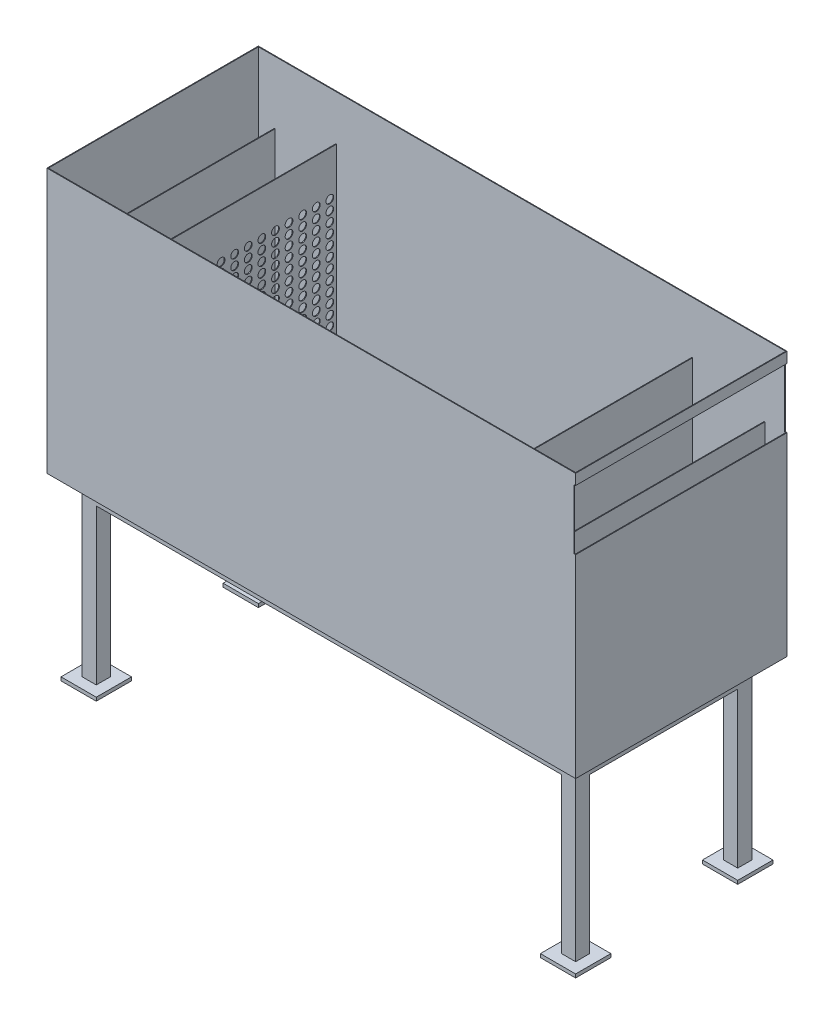
from build123d import *

# Parameters (mm, degrees)
MASTER_FOOTPRINT_W             = 1500
MASTER_FOOTPRINT_H             = 600
BATH_BASE_PLATE_DEPTH          = 750
BATH_SHELL_2MM_T               = -2
SKETCH_1_R                     = 50
INLET_D100_OPENING_DEPTH       = 10
INLET_IMPACT_BAFFLE_START      = 125
SKETCH_2_W                     = 440
SKETCH_2_H                     = 430
INLET_IMPACT_BAFFLE_DEPTH      = 2
DISTRIBUTOR_D22_START          = 250
SKETCH_3_W                     = 540
SKETCH_3_H                     = 648
SKETCH_3_R                     = 11
DISTRIBUTOR_D22_DEPTH          = 2
OUTLET_SUBMERGED_BAFFLE_START  = 1280
SKETCH_4_W                     = 500
SKETCH_4_H                     = 330
OUTLET_SUBMERGED_BAFFLE_DEPTH  = 2
OVERFLOW_WEIR_Z550_START       = 1440
SKETCH_5_W                     = 590
SKETCH_5_H                     = 548
OVERFLOW_WEIR_Z550_DEPTH       = 2
OUTLET_WEIR_SLOT_W600_START    = 1495
SKETCH_6_W                     = 600
SKETCH_6_H                     = 170
OUTLET_WEIR_SLOT_W600_DEPTH    = 10
SLOPED_SEDIMENT_FLOOR_START    = 275
SLOPED_SEDIMENT_FLOOR_DEPTH    = 975
SKETCH_8_W                     = 40
SKETCH_8_H                     = 40
FRAME_LEGS_40X40_H500_DEPTH    = 500
FRAME_LONGITUDINAL_RAILS_START = -20
SKETCH_9_W                     = 1400
SKETCH_9_H                     = 40
FRAME_LONGITUDINAL_RAILS_DEPTH = 40
FRAME_TRANSVERSE_RAILS_START   = -20
SKETCH_10_W                    = 40
SKETCH_10_H                    = 420
FRAME_TRANSVERSE_RAILS_DEPTH   = 40
FRAME_FOOT_PADS_100X100_START  = -500
SKETCH_11_W                    = 100
SKETCH_11_H                    = 100
FRAME_FOOT_PADS_100X100_DEPTH  = 10


with BuildPart() as part:
    # MASTER_FOOTPRINT → BATH_BASE_PLATE (new body)
    with BuildSketch(Plane(origin=(0, 0, 0), x_dir=(1, 0, 0), z_dir=(0, 1, 0))):
        with Locations((750, 300)):
            Rectangle(MASTER_FOOTPRINT_W, MASTER_FOOTPRINT_H)
    extrude(amount=BATH_BASE_PLATE_DEPTH)

    # BATH_SHELL_2MM
    bath_shell_2mm_openings = [part.faces().sort_by_distance(p)[0] for p in [
        (750, 750, -300),
    ]]
    offset(amount=BATH_SHELL_2MM_T, openings=bath_shell_2mm_openings, kind=Kind.INTERSECTION)

    # Эскиз1 → INLET_D100_OPENING (cut)
    with BuildSketch(Plane(origin=(0, 0, 0), x_dir=(0, 0, -1), z_dir=(1, 0, 0))):
        with Locations((300, 420)):
            Circle(SKETCH_1_R)
    extrude(amount=INLET_D100_OPENING_DEPTH, mode=Mode.SUBTRACT)

    # Эскиз6 → OUTLET_WEIR_SLOT_W600 (cut)
    with BuildSketch(Plane(origin=(0, 0, 0), x_dir=(0, 0, -1), z_dir=(1, 0, 0)).offset(OUTLET_WEIR_SLOT_W600_START)):
        with Locations((300, 635)):
            Rectangle(SKETCH_6_W, SKETCH_6_H)
    extrude(amount=OUTLET_WEIR_SLOT_W600_DEPTH, mode=Mode.SUBTRACT)

    # Эскиз7 → SLOPED_SEDIMENT_FLOOR (add)
    with BuildSketch(Plane(origin=(0, 0, 0), x_dir=(0, 0, -1), z_dir=(1, 0, 0)).offset(SLOPED_SEDIMENT_FLOOR_START)):
        Polygon((2, -1), (2, 120), (230, -1), align=None)
        Polygon((598, -1), (598, 120), (370, -1), align=None)
    extrude(amount=SLOPED_SEDIMENT_FLOOR_DEPTH)

    # Эскиз8 → FRAME_LEGS_40X40_H500 (add)
    with BuildSketch(Plane(origin=(0, 0, 0), x_dir=(1, 0, 0), z_dir=(0, 1, 0))):
        with Locations((70, 70)):
            Rectangle(SKETCH_8_W, SKETCH_8_H)
        with Locations((70, 530)):
            Rectangle(SKETCH_8_W, SKETCH_8_H)
        with Locations((1430, 70)):
            Rectangle(SKETCH_8_W, SKETCH_8_H)
        with Locations((1430, 530)):
            Rectangle(SKETCH_8_W, SKETCH_8_H)
    extrude(amount=-FRAME_LEGS_40X40_H500_DEPTH)

    # Эскиз9 → FRAME_LONGITUDINAL_RAILS (add)
    with BuildSketch(Plane(origin=(0, 0, 0), x_dir=(1, 0, 0), z_dir=(0, 1, 0)).offset(FRAME_LONGITUDINAL_RAILS_START)):
        with Locations((750, 70)):
            Rectangle(SKETCH_9_W, SKETCH_9_H)
        with Locations((750, 530)):
            Rectangle(SKETCH_9_W, SKETCH_9_H)
    extrude(amount=-FRAME_LONGITUDINAL_RAILS_DEPTH)

    # Эскиз10 → FRAME_TRANSVERSE_RAILS (add)
    with BuildSketch(Plane(origin=(0, 0, 0), x_dir=(1, 0, 0), z_dir=(0, 1, 0)).offset(FRAME_TRANSVERSE_RAILS_START)):
        with Locations((70, 300)):
            Rectangle(SKETCH_10_W, SKETCH_10_H)
        with Locations((1430, 300)):
            Rectangle(SKETCH_10_W, SKETCH_10_H)
    extrude(amount=-FRAME_TRANSVERSE_RAILS_DEPTH)

    # Эскиз11 → FRAME_FOOT_PADS_100X100 (add)
    with BuildSketch(Plane(origin=(0, 0, 0), x_dir=(1, 0, 0), z_dir=(0, 1, 0)).offset(FRAME_FOOT_PADS_100X100_START)):
        with Locations((70, 70)):
            Rectangle(SKETCH_11_W, SKETCH_11_H)
        with Locations((70, 530)):
            Rectangle(SKETCH_11_W, SKETCH_11_H)
        with Locations((1430, 70)):
            Rectangle(SKETCH_11_W, SKETCH_11_H)
        with Locations((1430, 530)):
            Rectangle(SKETCH_11_W, SKETCH_11_H)
    extrude(amount=-FRAME_FOOT_PADS_100X100_DEPTH)


with BuildPart() as body_2:
    # Эскиз2 → INLET_IMPACT_BAFFLE (new body)
    with BuildSketch(Plane(origin=(0, 0, 0), x_dir=(0, 0, -1), z_dir=(1, 0, 0)).offset(INLET_IMPACT_BAFFLE_START)):
        with Locations((300, 435)):
            Rectangle(SKETCH_2_W, SKETCH_2_H)
    extrude(amount=INLET_IMPACT_BAFFLE_DEPTH)


with BuildPart() as body_3:
    # Эскиз3 → DISTRIBUTOR_D22 (new body)
    with BuildSketch(Plane(origin=(0, 0, 0), x_dir=(0, 0, -1), z_dir=(1, 0, 0)).offset(DISTRIBUTOR_D22_START)):
        with Locations((300, 326)):
            Rectangle(SKETCH_3_W, SKETCH_3_H)
        with Locations((49.285714286, 125)):
            Circle(SKETCH_3_R, mode=Mode.SUBTRACT)
        with Locations((49.285714286, 153.5)):
            Circle(SKETCH_3_R, mode=Mode.SUBTRACT)
        with Locations((49.285714286, 182)):
            Circle(SKETCH_3_R, mode=Mode.SUBTRACT)
        with Locations((49.285714286, 210.5)):
            Circle(SKETCH_3_R, mode=Mode.SUBTRACT)
        with Locations((49.285714286, 239)):
            Circle(SKETCH_3_R, mode=Mode.SUBTRACT)
        with Locations((49.285714286, 267.5)):
            Circle(SKETCH_3_R, mode=Mode.SUBTRACT)
        with Locations((49.285714286, 296)):
            Circle(SKETCH_3_R, mode=Mode.SUBTRACT)
        with Locations((49.285714286, 324.5)):
            Circle(SKETCH_3_R, mode=Mode.SUBTRACT)
        with Locations((49.285714286, 353)):
            Circle(SKETCH_3_R, mode=Mode.SUBTRACT)
        with Locations((49.285714286, 381.5)):
            Circle(SKETCH_3_R, mode=Mode.SUBTRACT)
        with Locations((49.285714286, 410)):
            Circle(SKETCH_3_R, mode=Mode.SUBTRACT)
        with Locations((49.285714286, 438.5)):
            Circle(SKETCH_3_R, mode=Mode.SUBTRACT)
        with Locations((49.285714286, 467)):
            Circle(SKETCH_3_R, mode=Mode.SUBTRACT)
        with Locations((49.285714286, 495.5)):
            Circle(SKETCH_3_R, mode=Mode.SUBTRACT)
        with Locations((49.285714286, 524)):
            Circle(SKETCH_3_R, mode=Mode.SUBTRACT)
        with Locations((87.857142857, 125)):
            Circle(SKETCH_3_R, mode=Mode.SUBTRACT)
        with Locations((87.857142857, 153.5)):
            Circle(SKETCH_3_R, mode=Mode.SUBTRACT)
        with Locations((87.857142857, 182)):
            Circle(SKETCH_3_R, mode=Mode.SUBTRACT)
        with Locations((87.857142857, 210.5)):
            Circle(SKETCH_3_R, mode=Mode.SUBTRACT)
        with Locations((87.857142857, 239)):
            Circle(SKETCH_3_R, mode=Mode.SUBTRACT)
        with Locations((87.857142857, 267.5)):
            Circle(SKETCH_3_R, mode=Mode.SUBTRACT)
        with Locations((87.857142857, 296)):
            Circle(SKETCH_3_R, mode=Mode.SUBTRACT)
        with Locations((87.857142857, 324.5)):
            Circle(SKETCH_3_R, mode=Mode.SUBTRACT)
        with Locations((87.857142857, 353)):
            Circle(SKETCH_3_R, mode=Mode.SUBTRACT)
        with Locations((87.857142857, 381.5)):
            Circle(SKETCH_3_R, mode=Mode.SUBTRACT)
        with Locations((87.857142857, 410)):
            Circle(SKETCH_3_R, mode=Mode.SUBTRACT)
        with Locations((87.857142857, 438.5)):
            Circle(SKETCH_3_R, mode=Mode.SUBTRACT)
        with Locations((87.857142857, 467)):
            Circle(SKETCH_3_R, mode=Mode.SUBTRACT)
        with Locations((87.857142857, 495.5)):
            Circle(SKETCH_3_R, mode=Mode.SUBTRACT)
        with Locations((87.857142857, 524)):
            Circle(SKETCH_3_R, mode=Mode.SUBTRACT)
        with Locations((126.428571429, 125)):
            Circle(SKETCH_3_R, mode=Mode.SUBTRACT)
        with Locations((126.428571429, 153.5)):
            Circle(SKETCH_3_R, mode=Mode.SUBTRACT)
        with Locations((126.428571429, 182)):
            Circle(SKETCH_3_R, mode=Mode.SUBTRACT)
        with Locations((126.428571429, 210.5)):
            Circle(SKETCH_3_R, mode=Mode.SUBTRACT)
        with Locations((126.428571429, 239)):
            Circle(SKETCH_3_R, mode=Mode.SUBTRACT)
        with Locations((126.428571429, 267.5)):
            Circle(SKETCH_3_R, mode=Mode.SUBTRACT)
        with Locations((126.428571429, 296)):
            Circle(SKETCH_3_R, mode=Mode.SUBTRACT)
        with Locations((126.428571429, 324.5)):
            Circle(SKETCH_3_R, mode=Mode.SUBTRACT)
        with Locations((126.428571429, 353)):
            Circle(SKETCH_3_R, mode=Mode.SUBTRACT)
        with Locations((126.428571429, 381.5)):
            Circle(SKETCH_3_R, mode=Mode.SUBTRACT)
        with Locations((126.428571429, 410)):
            Circle(SKETCH_3_R, mode=Mode.SUBTRACT)
        with Locations((126.428571429, 438.5)):
            Circle(SKETCH_3_R, mode=Mode.SUBTRACT)
        with Locations((126.428571429, 467)):
            Circle(SKETCH_3_R, mode=Mode.SUBTRACT)
        with Locations((126.428571429, 495.5)):
            Circle(SKETCH_3_R, mode=Mode.SUBTRACT)
        with Locations((126.428571429, 524)):
            Circle(SKETCH_3_R, mode=Mode.SUBTRACT)
        with Locations((165, 125)):
            Circle(SKETCH_3_R, mode=Mode.SUBTRACT)
        with Locations((165, 153.5)):
            Circle(SKETCH_3_R, mode=Mode.SUBTRACT)
        with Locations((165, 182)):
            Circle(SKETCH_3_R, mode=Mode.SUBTRACT)
        with Locations((165, 210.5)):
            Circle(SKETCH_3_R, mode=Mode.SUBTRACT)
        with Locations((165, 239)):
            Circle(SKETCH_3_R, mode=Mode.SUBTRACT)
        with Locations((165, 267.5)):
            Circle(SKETCH_3_R, mode=Mode.SUBTRACT)
        with Locations((165, 296)):
            Circle(SKETCH_3_R, mode=Mode.SUBTRACT)
        with Locations((165, 324.5)):
            Circle(SKETCH_3_R, mode=Mode.SUBTRACT)
        with Locations((165, 353)):
            Circle(SKETCH_3_R, mode=Mode.SUBTRACT)
        with Locations((165, 381.5)):
            Circle(SKETCH_3_R, mode=Mode.SUBTRACT)
        with Locations((165, 410)):
            Circle(SKETCH_3_R, mode=Mode.SUBTRACT)
        with Locations((165, 438.5)):
            Circle(SKETCH_3_R, mode=Mode.SUBTRACT)
        with Locations((165, 467)):
            Circle(SKETCH_3_R, mode=Mode.SUBTRACT)
        with Locations((165, 495.5)):
            Circle(SKETCH_3_R, mode=Mode.SUBTRACT)
        with Locations((165, 524)):
            Circle(SKETCH_3_R, mode=Mode.SUBTRACT)
        with Locations((203.571428571, 125)):
            Circle(SKETCH_3_R, mode=Mode.SUBTRACT)
        with Locations((203.571428571, 153.5)):
            Circle(SKETCH_3_R, mode=Mode.SUBTRACT)
        with Locations((203.571428571, 182)):
            Circle(SKETCH_3_R, mode=Mode.SUBTRACT)
        with Locations((203.571428571, 210.5)):
            Circle(SKETCH_3_R, mode=Mode.SUBTRACT)
        with Locations((203.571428571, 239)):
            Circle(SKETCH_3_R, mode=Mode.SUBTRACT)
        with Locations((203.571428571, 267.5)):
            Circle(SKETCH_3_R, mode=Mode.SUBTRACT)
        with Locations((203.571428571, 296)):
            Circle(SKETCH_3_R, mode=Mode.SUBTRACT)
        with Locations((203.571428571, 324.5)):
            Circle(SKETCH_3_R, mode=Mode.SUBTRACT)
        with Locations((203.571428571, 353)):
            Circle(SKETCH_3_R, mode=Mode.SUBTRACT)
        with Locations((203.571428571, 381.5)):
            Circle(SKETCH_3_R, mode=Mode.SUBTRACT)
        with Locations((203.571428571, 410)):
            Circle(SKETCH_3_R, mode=Mode.SUBTRACT)
        with Locations((203.571428571, 438.5)):
            Circle(SKETCH_3_R, mode=Mode.SUBTRACT)
        with Locations((203.571428571, 467)):
            Circle(SKETCH_3_R, mode=Mode.SUBTRACT)
        with Locations((203.571428571, 495.5)):
            Circle(SKETCH_3_R, mode=Mode.SUBTRACT)
        with Locations((203.571428571, 524)):
            Circle(SKETCH_3_R, mode=Mode.SUBTRACT)
        with Locations((242.142857143, 125)):
            Circle(SKETCH_3_R, mode=Mode.SUBTRACT)
        with Locations((242.142857143, 153.5)):
            Circle(SKETCH_3_R, mode=Mode.SUBTRACT)
        with Locations((242.142857143, 182)):
            Circle(SKETCH_3_R, mode=Mode.SUBTRACT)
        with Locations((242.142857143, 210.5)):
            Circle(SKETCH_3_R, mode=Mode.SUBTRACT)
        with Locations((242.142857143, 239)):
            Circle(SKETCH_3_R, mode=Mode.SUBTRACT)
        with Locations((242.142857143, 267.5)):
            Circle(SKETCH_3_R, mode=Mode.SUBTRACT)
        with Locations((242.142857143, 296)):
            Circle(SKETCH_3_R, mode=Mode.SUBTRACT)
        with Locations((242.142857143, 324.5)):
            Circle(SKETCH_3_R, mode=Mode.SUBTRACT)
        with Locations((242.142857143, 353)):
            Circle(SKETCH_3_R, mode=Mode.SUBTRACT)
        with Locations((242.142857143, 381.5)):
            Circle(SKETCH_3_R, mode=Mode.SUBTRACT)
        with Locations((242.142857143, 410)):
            Circle(SKETCH_3_R, mode=Mode.SUBTRACT)
        with Locations((242.142857143, 438.5)):
            Circle(SKETCH_3_R, mode=Mode.SUBTRACT)
        with Locations((242.142857143, 467)):
            Circle(SKETCH_3_R, mode=Mode.SUBTRACT)
        with Locations((242.142857143, 495.5)):
            Circle(SKETCH_3_R, mode=Mode.SUBTRACT)
        with Locations((242.142857143, 524)):
            Circle(SKETCH_3_R, mode=Mode.SUBTRACT)
        with Locations((280.714285714, 125)):
            Circle(SKETCH_3_R, mode=Mode.SUBTRACT)
        with Locations((280.714285714, 153.5)):
            Circle(SKETCH_3_R, mode=Mode.SUBTRACT)
        with Locations((280.714285714, 182)):
            Circle(SKETCH_3_R, mode=Mode.SUBTRACT)
        with Locations((280.714285714, 210.5)):
            Circle(SKETCH_3_R, mode=Mode.SUBTRACT)
        with Locations((280.714285714, 239)):
            Circle(SKETCH_3_R, mode=Mode.SUBTRACT)
        with Locations((280.714285714, 267.5)):
            Circle(SKETCH_3_R, mode=Mode.SUBTRACT)
        with Locations((280.714285714, 296)):
            Circle(SKETCH_3_R, mode=Mode.SUBTRACT)
        with Locations((280.714285714, 324.5)):
            Circle(SKETCH_3_R, mode=Mode.SUBTRACT)
        with Locations((280.714285714, 353)):
            Circle(SKETCH_3_R, mode=Mode.SUBTRACT)
        with Locations((280.714285714, 381.5)):
            Circle(SKETCH_3_R, mode=Mode.SUBTRACT)
        with Locations((280.714285714, 410)):
            Circle(SKETCH_3_R, mode=Mode.SUBTRACT)
        with Locations((280.714285714, 438.5)):
            Circle(SKETCH_3_R, mode=Mode.SUBTRACT)
        with Locations((280.714285714, 467)):
            Circle(SKETCH_3_R, mode=Mode.SUBTRACT)
        with Locations((280.714285714, 495.5)):
            Circle(SKETCH_3_R, mode=Mode.SUBTRACT)
        with Locations((280.714285714, 524)):
            Circle(SKETCH_3_R, mode=Mode.SUBTRACT)
        with Locations((319.285714286, 125)):
            Circle(SKETCH_3_R, mode=Mode.SUBTRACT)
        with Locations((319.285714286, 153.5)):
            Circle(SKETCH_3_R, mode=Mode.SUBTRACT)
        with Locations((319.285714286, 182)):
            Circle(SKETCH_3_R, mode=Mode.SUBTRACT)
        with Locations((319.285714286, 210.5)):
            Circle(SKETCH_3_R, mode=Mode.SUBTRACT)
        with Locations((319.285714286, 239)):
            Circle(SKETCH_3_R, mode=Mode.SUBTRACT)
        with Locations((319.285714286, 267.5)):
            Circle(SKETCH_3_R, mode=Mode.SUBTRACT)
        with Locations((319.285714286, 296)):
            Circle(SKETCH_3_R, mode=Mode.SUBTRACT)
        with Locations((319.285714286, 324.5)):
            Circle(SKETCH_3_R, mode=Mode.SUBTRACT)
        with Locations((319.285714286, 353)):
            Circle(SKETCH_3_R, mode=Mode.SUBTRACT)
        with Locations((319.285714286, 381.5)):
            Circle(SKETCH_3_R, mode=Mode.SUBTRACT)
        with Locations((319.285714286, 410)):
            Circle(SKETCH_3_R, mode=Mode.SUBTRACT)
        with Locations((319.285714286, 438.5)):
            Circle(SKETCH_3_R, mode=Mode.SUBTRACT)
        with Locations((319.285714286, 467)):
            Circle(SKETCH_3_R, mode=Mode.SUBTRACT)
        with Locations((319.285714286, 495.5)):
            Circle(SKETCH_3_R, mode=Mode.SUBTRACT)
        with Locations((319.285714286, 524)):
            Circle(SKETCH_3_R, mode=Mode.SUBTRACT)
        with Locations((357.857142857, 125)):
            Circle(SKETCH_3_R, mode=Mode.SUBTRACT)
        with Locations((357.857142857, 153.5)):
            Circle(SKETCH_3_R, mode=Mode.SUBTRACT)
        with Locations((357.857142857, 182)):
            Circle(SKETCH_3_R, mode=Mode.SUBTRACT)
        with Locations((357.857142857, 210.5)):
            Circle(SKETCH_3_R, mode=Mode.SUBTRACT)
        with Locations((357.857142857, 239)):
            Circle(SKETCH_3_R, mode=Mode.SUBTRACT)
        with Locations((357.857142857, 267.5)):
            Circle(SKETCH_3_R, mode=Mode.SUBTRACT)
        with Locations((357.857142857, 296)):
            Circle(SKETCH_3_R, mode=Mode.SUBTRACT)
        with Locations((357.857142857, 324.5)):
            Circle(SKETCH_3_R, mode=Mode.SUBTRACT)
        with Locations((357.857142857, 353)):
            Circle(SKETCH_3_R, mode=Mode.SUBTRACT)
        with Locations((357.857142857, 381.5)):
            Circle(SKETCH_3_R, mode=Mode.SUBTRACT)
        with Locations((357.857142857, 410)):
            Circle(SKETCH_3_R, mode=Mode.SUBTRACT)
        with Locations((357.857142857, 438.5)):
            Circle(SKETCH_3_R, mode=Mode.SUBTRACT)
        with Locations((357.857142857, 467)):
            Circle(SKETCH_3_R, mode=Mode.SUBTRACT)
        with Locations((357.857142857, 495.5)):
            Circle(SKETCH_3_R, mode=Mode.SUBTRACT)
        with Locations((357.857142857, 524)):
            Circle(SKETCH_3_R, mode=Mode.SUBTRACT)
        with Locations((396.428571429, 125)):
            Circle(SKETCH_3_R, mode=Mode.SUBTRACT)
        with Locations((396.428571429, 153.5)):
            Circle(SKETCH_3_R, mode=Mode.SUBTRACT)
        with Locations((396.428571429, 182)):
            Circle(SKETCH_3_R, mode=Mode.SUBTRACT)
        with Locations((396.428571429, 210.5)):
            Circle(SKETCH_3_R, mode=Mode.SUBTRACT)
        with Locations((396.428571429, 239)):
            Circle(SKETCH_3_R, mode=Mode.SUBTRACT)
        with Locations((396.428571429, 267.5)):
            Circle(SKETCH_3_R, mode=Mode.SUBTRACT)
        with Locations((396.428571429, 296)):
            Circle(SKETCH_3_R, mode=Mode.SUBTRACT)
        with Locations((396.428571429, 324.5)):
            Circle(SKETCH_3_R, mode=Mode.SUBTRACT)
        with Locations((396.428571429, 353)):
            Circle(SKETCH_3_R, mode=Mode.SUBTRACT)
        with Locations((396.428571429, 381.5)):
            Circle(SKETCH_3_R, mode=Mode.SUBTRACT)
        with Locations((396.428571429, 410)):
            Circle(SKETCH_3_R, mode=Mode.SUBTRACT)
        with Locations((396.428571429, 438.5)):
            Circle(SKETCH_3_R, mode=Mode.SUBTRACT)
        with Locations((396.428571429, 467)):
            Circle(SKETCH_3_R, mode=Mode.SUBTRACT)
        with Locations((396.428571429, 495.5)):
            Circle(SKETCH_3_R, mode=Mode.SUBTRACT)
        with Locations((396.428571429, 524)):
            Circle(SKETCH_3_R, mode=Mode.SUBTRACT)
        with Locations((435, 125)):
            Circle(SKETCH_3_R, mode=Mode.SUBTRACT)
        with Locations((435, 153.5)):
            Circle(SKETCH_3_R, mode=Mode.SUBTRACT)
        with Locations((435, 182)):
            Circle(SKETCH_3_R, mode=Mode.SUBTRACT)
        with Locations((435, 210.5)):
            Circle(SKETCH_3_R, mode=Mode.SUBTRACT)
        with Locations((435, 239)):
            Circle(SKETCH_3_R, mode=Mode.SUBTRACT)
        with Locations((435, 267.5)):
            Circle(SKETCH_3_R, mode=Mode.SUBTRACT)
        with Locations((435, 296)):
            Circle(SKETCH_3_R, mode=Mode.SUBTRACT)
        with Locations((435, 324.5)):
            Circle(SKETCH_3_R, mode=Mode.SUBTRACT)
        with Locations((435, 353)):
            Circle(SKETCH_3_R, mode=Mode.SUBTRACT)
        with Locations((435, 381.5)):
            Circle(SKETCH_3_R, mode=Mode.SUBTRACT)
        with Locations((435, 410)):
            Circle(SKETCH_3_R, mode=Mode.SUBTRACT)
        with Locations((435, 438.5)):
            Circle(SKETCH_3_R, mode=Mode.SUBTRACT)
        with Locations((435, 467)):
            Circle(SKETCH_3_R, mode=Mode.SUBTRACT)
        with Locations((435, 495.5)):
            Circle(SKETCH_3_R, mode=Mode.SUBTRACT)
        with Locations((435, 524)):
            Circle(SKETCH_3_R, mode=Mode.SUBTRACT)
        with Locations((473.571428571, 125)):
            Circle(SKETCH_3_R, mode=Mode.SUBTRACT)
        with Locations((473.571428571, 153.5)):
            Circle(SKETCH_3_R, mode=Mode.SUBTRACT)
        with Locations((473.571428571, 182)):
            Circle(SKETCH_3_R, mode=Mode.SUBTRACT)
        with Locations((473.571428571, 210.5)):
            Circle(SKETCH_3_R, mode=Mode.SUBTRACT)
        with Locations((473.571428571, 239)):
            Circle(SKETCH_3_R, mode=Mode.SUBTRACT)
        with Locations((473.571428571, 267.5)):
            Circle(SKETCH_3_R, mode=Mode.SUBTRACT)
        with Locations((473.571428571, 296)):
            Circle(SKETCH_3_R, mode=Mode.SUBTRACT)
        with Locations((473.571428571, 324.5)):
            Circle(SKETCH_3_R, mode=Mode.SUBTRACT)
        with Locations((473.571428571, 353)):
            Circle(SKETCH_3_R, mode=Mode.SUBTRACT)
        with Locations((473.571428571, 381.5)):
            Circle(SKETCH_3_R, mode=Mode.SUBTRACT)
        with Locations((473.571428571, 410)):
            Circle(SKETCH_3_R, mode=Mode.SUBTRACT)
        with Locations((473.571428571, 438.5)):
            Circle(SKETCH_3_R, mode=Mode.SUBTRACT)
        with Locations((473.571428571, 467)):
            Circle(SKETCH_3_R, mode=Mode.SUBTRACT)
        with Locations((473.571428571, 495.5)):
            Circle(SKETCH_3_R, mode=Mode.SUBTRACT)
        with Locations((473.571428571, 524)):
            Circle(SKETCH_3_R, mode=Mode.SUBTRACT)
        with Locations((512.142857143, 125)):
            Circle(SKETCH_3_R, mode=Mode.SUBTRACT)
        with Locations((512.142857143, 153.5)):
            Circle(SKETCH_3_R, mode=Mode.SUBTRACT)
        with Locations((512.142857143, 182)):
            Circle(SKETCH_3_R, mode=Mode.SUBTRACT)
        with Locations((512.142857143, 210.5)):
            Circle(SKETCH_3_R, mode=Mode.SUBTRACT)
        with Locations((512.142857143, 239)):
            Circle(SKETCH_3_R, mode=Mode.SUBTRACT)
        with Locations((512.142857143, 267.5)):
            Circle(SKETCH_3_R, mode=Mode.SUBTRACT)
        with Locations((512.142857143, 296)):
            Circle(SKETCH_3_R, mode=Mode.SUBTRACT)
        with Locations((512.142857143, 324.5)):
            Circle(SKETCH_3_R, mode=Mode.SUBTRACT)
        with Locations((512.142857143, 353)):
            Circle(SKETCH_3_R, mode=Mode.SUBTRACT)
        with Locations((512.142857143, 381.5)):
            Circle(SKETCH_3_R, mode=Mode.SUBTRACT)
        with Locations((512.142857143, 410)):
            Circle(SKETCH_3_R, mode=Mode.SUBTRACT)
        with Locations((512.142857143, 438.5)):
            Circle(SKETCH_3_R, mode=Mode.SUBTRACT)
        with Locations((512.142857143, 467)):
            Circle(SKETCH_3_R, mode=Mode.SUBTRACT)
        with Locations((512.142857143, 495.5)):
            Circle(SKETCH_3_R, mode=Mode.SUBTRACT)
        with Locations((512.142857143, 524)):
            Circle(SKETCH_3_R, mode=Mode.SUBTRACT)
        with Locations((550.714285714, 125)):
            Circle(SKETCH_3_R, mode=Mode.SUBTRACT)
        with Locations((550.714285714, 153.5)):
            Circle(SKETCH_3_R, mode=Mode.SUBTRACT)
        with Locations((550.714285714, 182)):
            Circle(SKETCH_3_R, mode=Mode.SUBTRACT)
        with Locations((550.714285714, 210.5)):
            Circle(SKETCH_3_R, mode=Mode.SUBTRACT)
        with Locations((550.714285714, 239)):
            Circle(SKETCH_3_R, mode=Mode.SUBTRACT)
        with Locations((550.714285714, 267.5)):
            Circle(SKETCH_3_R, mode=Mode.SUBTRACT)
        with Locations((550.714285714, 296)):
            Circle(SKETCH_3_R, mode=Mode.SUBTRACT)
        with Locations((550.714285714, 324.5)):
            Circle(SKETCH_3_R, mode=Mode.SUBTRACT)
        with Locations((550.714285714, 353)):
            Circle(SKETCH_3_R, mode=Mode.SUBTRACT)
        with Locations((550.714285714, 381.5)):
            Circle(SKETCH_3_R, mode=Mode.SUBTRACT)
        with Locations((550.714285714, 410)):
            Circle(SKETCH_3_R, mode=Mode.SUBTRACT)
        with Locations((550.714285714, 438.5)):
            Circle(SKETCH_3_R, mode=Mode.SUBTRACT)
        with Locations((550.714285714, 467)):
            Circle(SKETCH_3_R, mode=Mode.SUBTRACT)
        with Locations((550.714285714, 495.5)):
            Circle(SKETCH_3_R, mode=Mode.SUBTRACT)
        with Locations((550.714285714, 524)):
            Circle(SKETCH_3_R, mode=Mode.SUBTRACT)
    extrude(amount=DISTRIBUTOR_D22_DEPTH)


with BuildPart() as body_4:
    # Эскиз4 → OUTLET_SUBMERGED_BAFFLE (new body)
    with BuildSketch(Plane(origin=(0, 0, 0), x_dir=(0, 0, -1), z_dir=(1, 0, 0)).offset(OUTLET_SUBMERGED_BAFFLE_START)):
        with Locations((300, 485)):
            Rectangle(SKETCH_4_W, SKETCH_4_H)
    extrude(amount=OUTLET_SUBMERGED_BAFFLE_DEPTH)


with BuildPart() as body_5:
    # Эскиз5 → OVERFLOW_WEIR_Z550 (new body)
    with BuildSketch(Plane(origin=(0, 0, 0), x_dir=(0, 0, -1), z_dir=(1, 0, 0)).offset(OVERFLOW_WEIR_Z550_START)):
        with Locations((300, 276)):
            Rectangle(SKETCH_5_W, SKETCH_5_H)
    extrude(amount=OVERFLOW_WEIR_Z550_DEPTH)


solid = Compound([part.part, body_2.part, body_3.part, body_4.part, body_5.part])
